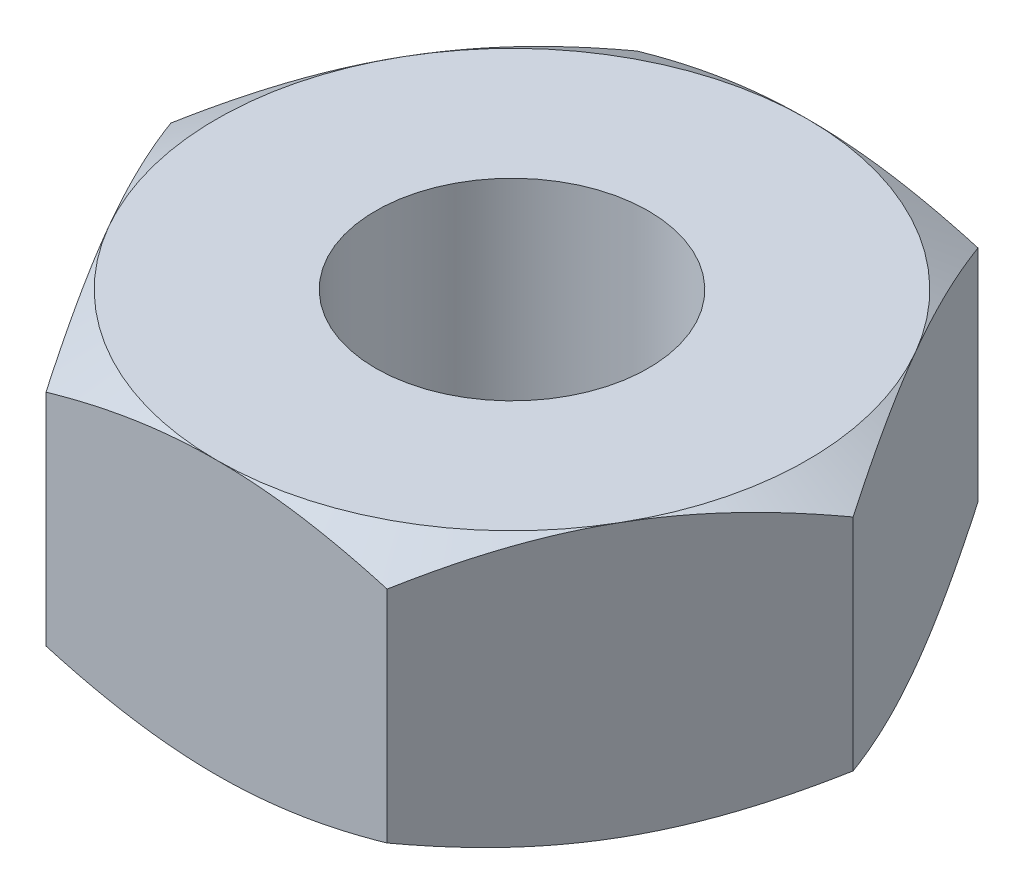
from build123d import *

# Parameters (mm, degrees)
SKETCH1_R               = 6
BOSS_EXTRUDE1_DEPTH     = 6
SKETCH2_OUTSIDE_W       = 57.64
SKETCH2_OUTSIDE_H       = 53.618
SKETCH2_OUTSIDE_R       = 13
CUT_EXTRUDE1_DEPTH      = 5
CUT_EXTRUDE1_DRAFT      = -60
MIRROR1_COPY_1_SKETCH_W = 57.64
MIRROR1_COPY_1_SKETCH_H = 53.618
MIRROR1_COPY_1_SKETCH_R = 13
MIRROR1_COPY_1_DEPTH    = 5
MIRROR1_COPY_1_DRAFT    = -60


with BuildPart() as part:
    # Sketch1 → Boss-Extrude1 (new, symmetric)
    with BuildSketch(Plane(origin=(0, 0, 0), x_dir=(1, 0, 0), z_dir=(0, 1, 0))):
        Polygon((7.505553499, -13), (15.011106999, 0), (7.505553499, 13), (-7.505553499, 13), (-15.011106999, 0), (-7.505553499, -13), align=None)
        with Locations(Location((0, 0, 0), (0, 0, 270))):
            Circle(SKETCH1_R, mode=Mode.SUBTRACT)
    extrude(amount=BOSS_EXTRUDE1_DEPTH, both=True)


with BuildPart() as cut_extrude1_tool:
    # Sketch2 outside → Cut-Extrude1 (with draft: the straight prism first)
    with BuildSketch(Plane(origin=(0, 6, 0), x_dir=(1, 0, 0), z_dir=(0, 1, 0))):
        Rectangle(SKETCH2_OUTSIDE_W, SKETCH2_OUTSIDE_H)
        Circle(SKETCH2_OUTSIDE_R, mode=Mode.SUBTRACT)
    extrude(amount=-CUT_EXTRUDE1_DEPTH)
    # Cut-Extrude1: the draft: its side faces are tilted about the plane it starts from
    cut_extrude1_sides = [cut_extrude1_tool.faces().sort_by_distance(p)[0] for p in [
        (0, 3.5, 26.809),
        (28.82, 3.5, 0),
        (0, 3.5, -26.809),
        (-28.82, 3.5, 0),
        (-13, 3.5, 0),
    ]]
    draft(cut_extrude1_sides, Plane(origin=(0, 6, 0), x_dir=(1, 0, 0), z_dir=(0, 1, 0)), CUT_EXTRUDE1_DRAFT)


with BuildPart() as part_1:
    add(part.part)

    # Cut-Extrude1: cut by cut_extrude1_tool
    add(cut_extrude1_tool.part, mode=Mode.SUBTRACT)


with BuildPart() as mirror1_copy_1_tool:
    # Mirror1 copy 1 sketch → Mirror1 copy 1 (with draft: the straight prism first)
    with BuildSketch(Plane.XZ.offset(6)):
        Rectangle(MIRROR1_COPY_1_SKETCH_W, MIRROR1_COPY_1_SKETCH_H)
        Circle(MIRROR1_COPY_1_SKETCH_R, mode=Mode.SUBTRACT)
    extrude(amount=-MIRROR1_COPY_1_DEPTH)
    # Mirror1 copy 1: the draft: its side faces are tilted about the plane it starts from
    mirror1_copy_1_sides = [mirror1_copy_1_tool.faces().sort_by_distance(p)[0] for p in [
        (0, -3.5, 26.809),
        (28.82, -3.5, 0),
        (0, -3.5, -26.809),
        (-28.82, -3.5, 0),
        (-13, -3.5, 0),
    ]]
    draft(mirror1_copy_1_sides, Plane.XZ.offset(6), MIRROR1_COPY_1_DRAFT)


with BuildPart() as part_2:
    add(part_1.part)

    # Mirror1 copy 1: cut by mirror1_copy_1_tool
    add(mirror1_copy_1_tool.part, mode=Mode.SUBTRACT)


solid = part_2.part
